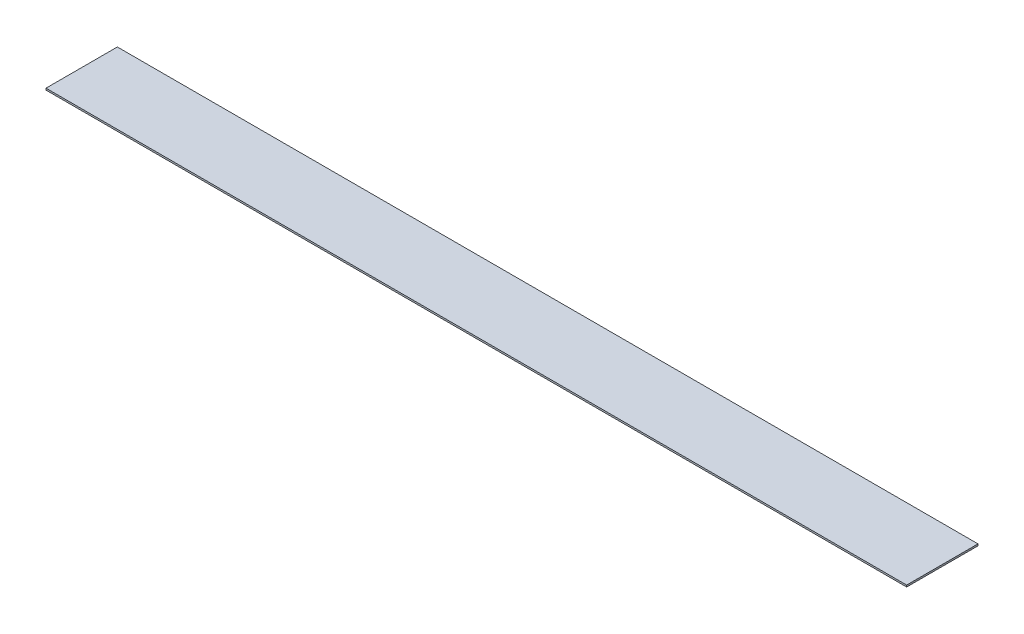
from build123d import *

# Parameters (mm, degrees)
SKETCH1_W           = 499.72
SKETCH1_H           = 41.42
BOSS_EXTRUDE1_DEPTH = 1


with BuildPart() as part:
    # Sketch1 → Boss-Extrude1 (new body)
    with BuildSketch(Plane(origin=(0, 0, 0), x_dir=(1, 0, 0), z_dir=(0, 1, 0))):
        Rectangle(SKETCH1_W, SKETCH1_H)
    extrude(amount=BOSS_EXTRUDE1_DEPTH)


solid = part.part
